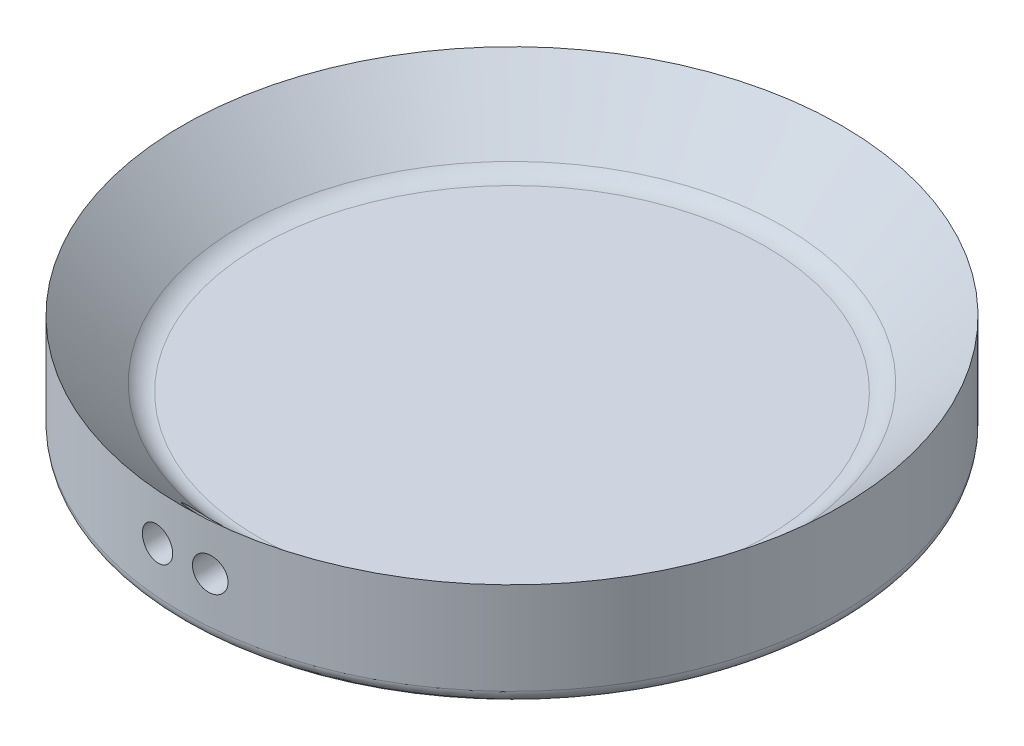
from build123d import *

# Parameters (mm, degrees)
CUT_EXTRUDE1_REACH = 58.471
SKETCH5_R          = 1.25


with BuildPart() as part:
    # Sketch3 → Revolve3 (revolve)
    with BuildSketch(Plane.XY, mode=Mode.PRIVATE) as revolve3_sk:
        with BuildLine():
            Line((-23, 0), (0, 0))
            Line((0, 0), (0, 3))
            Line((0, 3), (-19.171572875, 3))
            ThreePointArc((-19.171572875, 3), (-19.93693974, 3.152240935), (-20.585786438, 3.585786438))
            Line((-20.585786438, 3.585786438), (-25, 8))
            Line((-25, 8), (-25, 1))
            ThreePointArc((-25, 1), (-24.707106781, 0.292893219), (-24, 0))
            Line((-24, 0), (-23, 0))
        make_face()
    revolve(revolve3_sk.sketch.rotate(Axis((0, 0, 0), (0, 1, 0)), 270), axis=Axis((0, 0, 0), (0, 1, 0)))

    # Sketch5 → Cut-Extrude1 (cut, up to next)
    with BuildSketch(Plane.XY.offset(25), mode=Mode.PRIVATE) as cut_extrude1_sk1:
        with Locations((-2, 4.5)):
            Circle(SKETCH5_R)
    cut_extrude1_tool1 = extrude(cut_extrude1_sk1.sketch, amount=-CUT_EXTRUDE1_REACH, mode=Mode.PRIVATE) & part.part
    # Sketch5 → Cut-Extrude1 (cut, up to next)
    with BuildSketch(Plane.XY.offset(25), mode=Mode.PRIVATE) as cut_extrude1_sk2:
        with Locations((2, 4.5)):
            Circle(SKETCH5_R)
    cut_extrude1_tool2 = extrude(cut_extrude1_sk2.sketch, amount=-CUT_EXTRUDE1_REACH, mode=Mode.PRIVATE) & part.part
    add(cut_extrude1_tool1.solids().sort_by_distance((-2, 4.5, 25))[0], mode=Mode.SUBTRACT)
    add(cut_extrude1_tool2.solids().sort_by_distance((2, 4.5, 25))[0], mode=Mode.SUBTRACT)


solid = part.part
